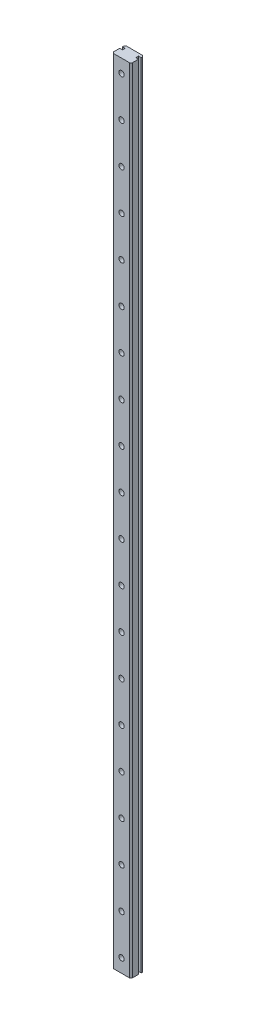
from build123d import *

# Parameters (mm, degrees)
EXTRUDE_1_DEPTH     = 295
SKETCH_2_R          = 1
CUT_EXTRUDE_1_DEPTH = 10
CHAMFER_1_SIZE      = 0.5
SKETCH_3_R          = 2.383304988
CUT_EXTRUDE_2_DEPTH = 1


with BuildPart() as part:
    # 草图1 → 凸台-拉伸1 (new body)
    with BuildSketch(Plane(origin=(0, 0, 0), x_dir=(1, 0, 0), z_dir=(0, 1, 0))):
        Polygon((-3.5, 0.4), (-3.5, -2.4), (3.5, -2.4), (3.5, 0.4), (2.5, 0.4), (2.5, 1.4), (3.5, 1.4), (3.5, 2.4), (-3.5, 2.4), (-3.5, 1.4), (-2.5, 1.4), (-2.5, 0.4), align=None)
    extrude(amount=EXTRUDE_1_DEPTH)

    # 草图2 → 切除-拉伸1 (cut)
    with BuildSketch(Plane(origin=(0, 0, -2.4), x_dir=(-1, 0, 0), z_dir=(0, 0, -1))):
        with Locations((0, 5)):
            Circle(SKETCH_2_R)
        with Locations((0, 20)):
            Circle(SKETCH_2_R)
        with Locations((0, 35)):
            Circle(SKETCH_2_R)
        with Locations((0, 50)):
            Circle(SKETCH_2_R)
        with Locations((0, 65)):
            Circle(SKETCH_2_R)
        with Locations((0, 80)):
            Circle(SKETCH_2_R)
        with Locations((0, 95)):
            Circle(SKETCH_2_R)
        with Locations((0, 110)):
            Circle(SKETCH_2_R)
        with Locations((0, 125)):
            Circle(SKETCH_2_R)
        with Locations((0, 140)):
            Circle(SKETCH_2_R)
        with Locations((0, 155)):
            Circle(SKETCH_2_R)
        with Locations((0, 170)):
            Circle(SKETCH_2_R)
        with Locations((0, 185)):
            Circle(SKETCH_2_R)
        with Locations((0, 200)):
            Circle(SKETCH_2_R)
        with Locations((0, 215)):
            Circle(SKETCH_2_R)
        with Locations((0, 230)):
            Circle(SKETCH_2_R)
        with Locations((0, 245)):
            Circle(SKETCH_2_R)
        with Locations((0, 260)):
            Circle(SKETCH_2_R)
        with Locations((0, 275)):
            Circle(SKETCH_2_R)
        with Locations((0, 290)):
            Circle(SKETCH_2_R)
    extrude(amount=-CUT_EXTRUDE_1_DEPTH, mode=Mode.SUBTRACT)

    # 倒角1
    chamfer_1_edges = [part.edges().sort_by_distance(p)[0] for p in [
        (-3.5, 147.5, -2.4),
        (3.5, 147.5, -2.4),
        (3.5, 147.5, 2.4),
        (-3.5, 147.5, 2.4),
    ]]
    chamfer(chamfer_1_edges, length=CHAMFER_1_SIZE)

    # 草图3 → 切除-拉伸2 (cut)
    with BuildSketch(Plane(origin=(0, 0, -2.4), x_dir=(-1, 0, 0), z_dir=(0, 0, -1))):
        with Locations((0, 5)):
            Circle(SKETCH_3_R)
        with Locations((0, 20)):
            Circle(SKETCH_3_R)
        with Locations((0, 35)):
            Circle(SKETCH_3_R)
        with Locations((0, 50)):
            Circle(SKETCH_3_R)
        with Locations((0, 65)):
            Circle(SKETCH_3_R)
        with Locations((0, 80)):
            Circle(SKETCH_3_R)
        with Locations((0, 95)):
            Circle(SKETCH_3_R)
        with Locations((0, 110)):
            Circle(SKETCH_3_R)
        with Locations((0, 125)):
            Circle(SKETCH_3_R)
        with Locations((0, 140)):
            Circle(SKETCH_3_R)
        with Locations((0, 155)):
            Circle(SKETCH_3_R)
        with Locations((0, 170)):
            Circle(SKETCH_3_R)
        with Locations((0, 185)):
            Circle(SKETCH_3_R)
        with Locations((0, 200)):
            Circle(SKETCH_3_R)
        with Locations((0, 215)):
            Circle(SKETCH_3_R)
        with Locations((0, 230)):
            Circle(SKETCH_3_R)
        with Locations((0, 245)):
            Circle(SKETCH_3_R)
        with Locations((0, 260)):
            Circle(SKETCH_3_R)
        with Locations((0, 275)):
            Circle(SKETCH_3_R)
        with Locations((0, 290)):
            Circle(SKETCH_3_R)
    extrude(amount=-CUT_EXTRUDE_2_DEPTH, mode=Mode.SUBTRACT)


solid = part.part
